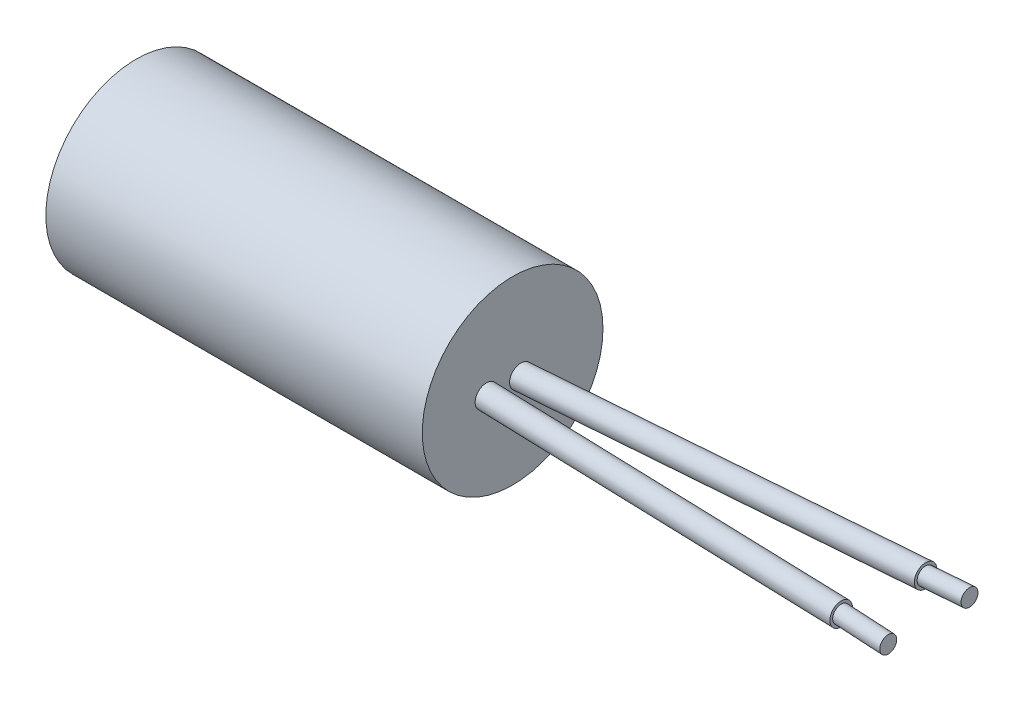
from build123d import *

# Parameters (mm, degrees)
SKETCH1_R      = 4.8
TUBE_DEPTH     = 20
SKETCH3_R      = 0.6
SKETCH6_R      = 0.6
SKETCH9_R      = 0.45
SKETCH10_R     = 0.45
SKETCH11_W     = 12.950895794
SKETCH11_H     = 9.583916724
WIRE_CUT_DEPTH = 5


with BuildPart() as part:
    # Sketch1 → Tube (new body)
    with BuildSketch(Plane(origin=(0, 0, 0), x_dir=(0, 0, -1), z_dir=(1, 0, 0))):
        Circle(SKETCH1_R)
    extrude(amount=TUBE_DEPTH)

    # Sweep1: sweep along a path in Sketch2
    with BuildLine(Plane(origin=(0, 0, 0), x_dir=(1, 0, 0), z_dir=(0, 1, 0))) as sweep1_path:
        Line((20, 0.437533256), (39.938874032, 2))
    # Sketch3 → Sweep1 (sweep)
    with BuildSketch(Plane(origin=(20, 0, 0), x_dir=(0, 0, -1), z_dir=(1, 0, 0))):
        with Locations((0.437533256, 0)):
            Circle(SKETCH3_R)
    sweep(path=sweep1_path.line)

    # Sweep2: sweep along a path in Sketch5
    with BuildLine(Plane(origin=(0, 0, 0), x_dir=(1, 0, 0), z_dir=(0, 1, 0))) as sweep2_path:
        Line((20, -1.392543459), (39.452849812, -2))
    # Sketch6 → Sweep2 (sweep)
    with BuildSketch(Plane(origin=(20, 0, 0), x_dir=(0, 0, -1), z_dir=(1, 0, 0))):
        with Locations((-1.392543459, 0)):
            Circle(SKETCH6_R)
    sweep(path=sweep2_path.line)

    # ca: sweep along a path in Sketch7
    with BuildLine(Plane(origin=(0, 0, 0), x_dir=(1, 0, 0), z_dir=(0, 1, 0))) as ca_path:
        Line((39.938874032, 2), (52.603130391, 2.998856902))
    # Sketch9 → ca (sweep)
    with BuildSketch(Plane(origin=(39.938874032, 0, 0), x_dir=(0, 0, -1), z_dir=(1, 0, 0))):
        with Locations((2, 0)):
            Circle(SKETCH9_R)
    sweep(path=ca_path.line)

    # an: sweep along a path in Sketch8
    with BuildLine(Plane(origin=(0, 0, 0), x_dir=(1, 0, 0), z_dir=(0, 1, 0))) as an_path:
        Line((39.452849812, -2), (53.102297824, -2.764258006))
    # Sketch10 → an (sweep)
    with BuildSketch(Plane(origin=(39.452849812, 0, 0), x_dir=(0, 0, -1), z_dir=(1, 0, 0))):
        with Locations((-2, 0)):
            Circle(SKETCH10_R)
    sweep(path=an_path.line)

    # Sketch11 → wire cut (cut, symmetric)
    with BuildSketch(Plane(origin=(0, 0, 0), x_dir=(1, 0, 0), z_dir=(0, 1, 0))):
        with Locations((48.578158556, -0.027699181)):
            Rectangle(SKETCH11_W, SKETCH11_H)
    extrude(amount=WIRE_CUT_DEPTH, both=True, mode=Mode.SUBTRACT)


solid = part.part
